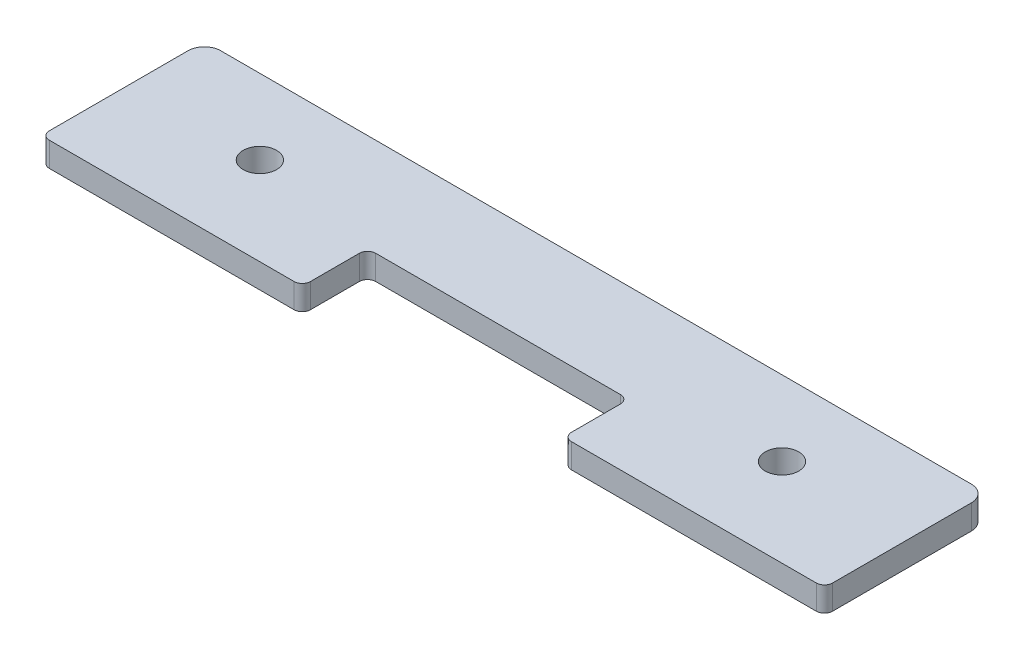
from build123d import *

# Parameters (mm, degrees)
SKETCH1_R           = 2.05
BOSS_EXTRUDE1_DEPTH = 3


with BuildPart() as part:
    # Sketch1 → Boss-Extrude1 (new body)
    with BuildSketch(Plane(origin=(0, 0, 0), x_dir=(1, 0, 0), z_dir=(0, 1, 0))):
        with BuildLine():
            Line((46, 20), (-46, 20))
            ThreePointArc((-46, 20), (-47.414213562, 19.414213562), (-48, 18))
            Line((-48, 18), (-48, 1))
            ThreePointArc((-48, 1), (-47.707106781, 0.292893219), (-47, 0))
            Line((-47, 0), (-17, 0))
            ThreePointArc((-17, 0), (-16.292893219, 0.292893219), (-16, 1))
            Line((-16, 1), (-16, 7))
            ThreePointArc((-16, 7), (-15.707106781, 7.707106781), (-15, 8))
            Line((-15, 8), (15, 8))
            ThreePointArc((15, 8), (15.707106781, 7.707106781), (16, 7))
            Line((16, 7), (16, 1))
            ThreePointArc((16, 1), (16.292893219, 0.292893219), (17, 0))
            Line((17, 0), (47, 0))
            ThreePointArc((47, 0), (47.707106781, 0.292893219), (48, 1))
            Line((48, 1), (48, 18))
            ThreePointArc((48, 18), (47.414213562, 19.414213562), (46, 20))
        make_face()
        with Locations(Location((32, 10.8, 0), (0, 0, 270))):
            Circle(SKETCH1_R, mode=Mode.SUBTRACT)
        with Locations(Location((-32, 10.8, 0), (0, 0, 90))):
            Circle(SKETCH1_R, mode=Mode.SUBTRACT)
    extrude(amount=BOSS_EXTRUDE1_DEPTH)


solid = part.part
